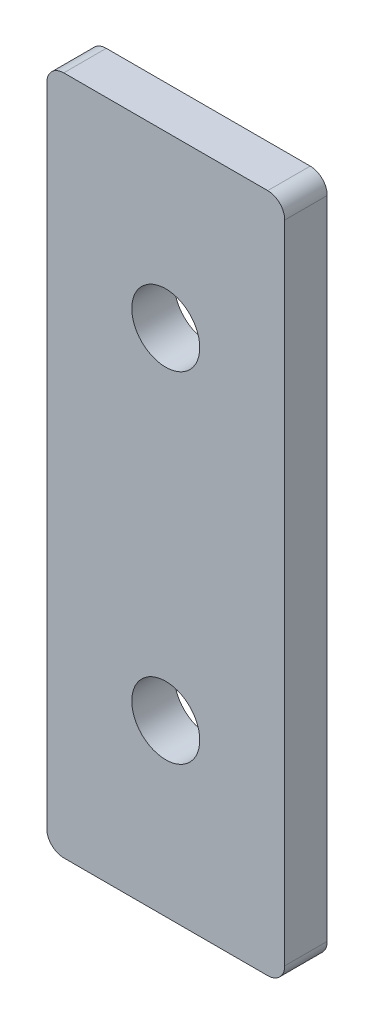
from build123d import *

# Parameters (mm, degrees)
SKETCH1_W           = 14
SKETCH1_H           = 40
SKETCH1_R           = 2
BOSS_EXTRUDE1_DEPTH = 2.5
FILLET1_R           = 1


with BuildPart() as part:
    # Sketch1 → Boss-Extrude1 (new body)
    with BuildSketch(Plane.XY):
        with Locations((7, 20)):
            Rectangle(SKETCH1_W, SKETCH1_H)
        with Locations((7, 10)):
            Circle(SKETCH1_R, mode=Mode.SUBTRACT)
        with Locations((7, 30)):
            Circle(SKETCH1_R, mode=Mode.SUBTRACT)
    extrude(amount=BOSS_EXTRUDE1_DEPTH)

    # Fillet1
    fillet1_edges = [part.edges().sort_by_distance(p)[0] for p in [
        (0, 40, 1.25),
        (14, 40, 1.25),
        (14, 0, 1.25),
        (0, 0, 1.25),
    ]]
    fillet(fillet1_edges, radius=FILLET1_R)


solid = part.part
